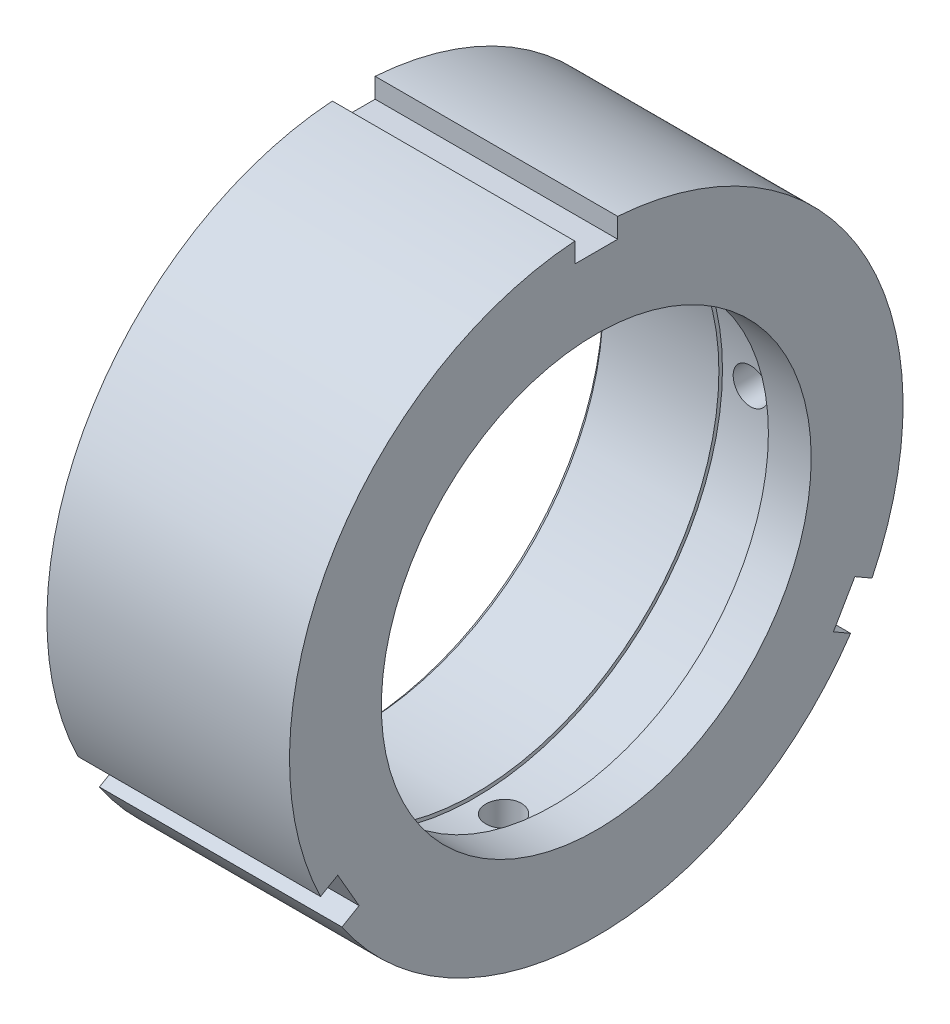
from build123d import *

# Parameters (mm, degrees)
SKETCH2_W          = 6
SKETCH2_H          = 3.873628034
CUT_EXTRUDE1_DEPTH = 70.670653793
CIRPATTERN1_COUNT  = 3
SKETCH4_W          = 2.5
SKETCH4_H          = 43
CIRPATTERN2_COUNT  = 2
CIRPATTERN2_ANGLE  = 90
FILLET1_R          = 0.762


with BuildPart() as part:
    # Sketch1 → Revolve1 (revolve)
    with BuildSketch(Plane.XY, mode=Mode.PRIVATE) as revolve1_sk:
        Polygon((0, 34.9501), (0, 43), (34, 43), (34, 30.125), (28, 30.125), (28, 34.6881), (17, 34.6881), (17, 34.1881), (0.762, 34.1881), align=None)
    revolve(revolve1_sk.sketch.rotate(Axis((0, 0, 0), (-1, 0, 0)), 90), axis=Axis((0, 0, 0), (-1, 0, 0)))

    # Sketch2 → Cut-Extrude1 (cut, through all)
    with BuildSketch(Plane.ZY):
        with Locations((0, 42.052814017)):
            Rectangle(SKETCH2_W, SKETCH2_H)
    cut_extrude1 = extrude(amount=-CUT_EXTRUDE1_DEPTH, mode=Mode.SUBTRACT)

    # CirPattern1: Cut-Extrude1 ×3 about axis
    cirpattern1_axis = Axis((0, 0, 0), (1, 0, 0))
    for i in range(1, CIRPATTERN1_COUNT):
        add(cut_extrude1.rotate(cirpattern1_axis, i * 360 / CIRPATTERN1_COUNT), mode=Mode.SUBTRACT)

    # Sketch4 → M6 Tapped Hole1 (revolve, cut)
    with BuildSketch(Plane(origin=(21, 0, 0), x_dir=(0, 0, 1), z_dir=(1, 0, 0))):
        with Locations((1.25, 21.5)):
            Rectangle(SKETCH4_W, SKETCH4_H)
    m6_tapped_hole1 = revolve(axis=Axis((21, 6.35, 0), (0, -1, 0)), mode=Mode.SUBTRACT)

    # CirPattern2: M6 Tapped Hole1 ×2 about axis
    cirpattern2_axis = Axis((0, 0, 0), (1, 0, 0))
    for i in range(1, CIRPATTERN2_COUNT):
        add(m6_tapped_hole1.rotate(cirpattern2_axis, i * CIRPATTERN2_ANGLE / (CIRPATTERN2_COUNT - 1)), mode=Mode.SUBTRACT)

    # Fillet1
    fillet1_edges = [part.edges().sort_by_distance(p)[0] for p in [
        (28, 0, 34.6881),
    ]]
    fillet(fillet1_edges, radius=FILLET1_R)


solid = part.part
